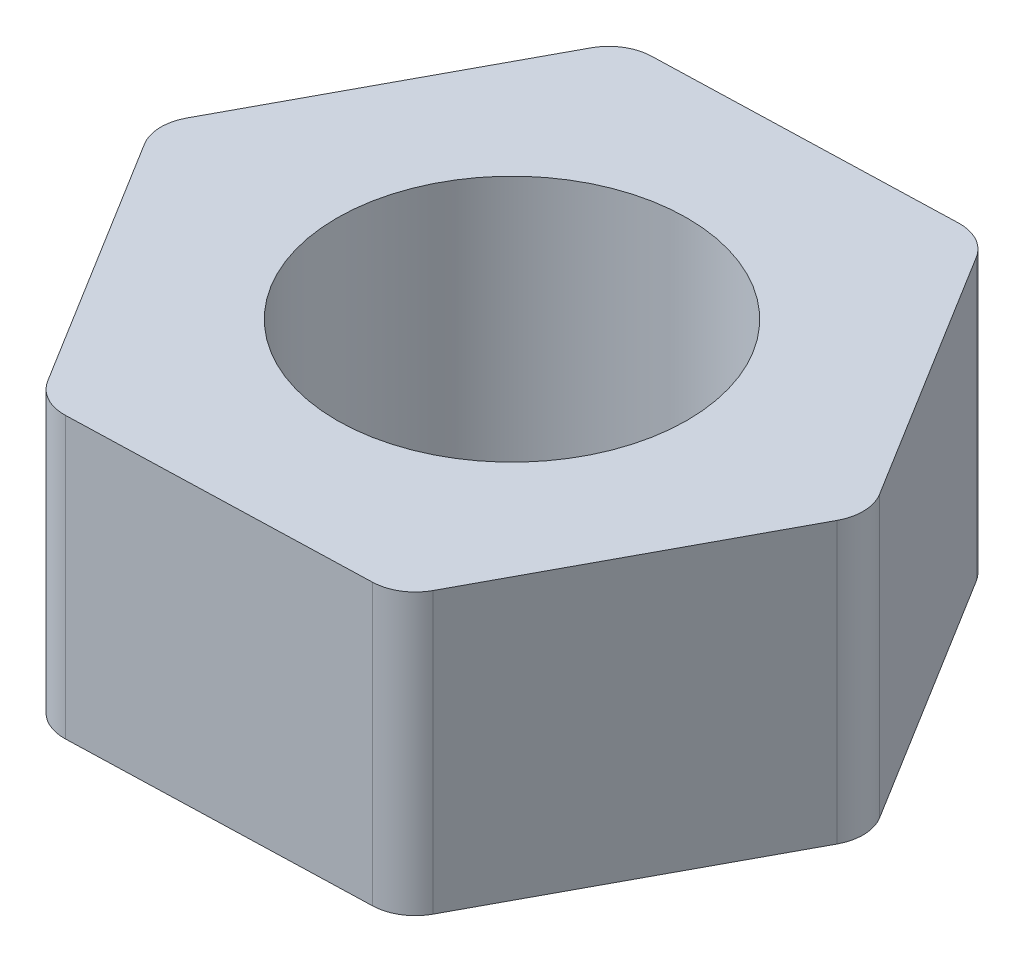
from build123d import *

# Parameters (mm, degrees)
SKETCH1_R           = 2
BOSS_EXTRUDE1_DEPTH = 3.2
FILLET1_R           = 0.5


with BuildPart() as part:
    # Sketch1 → Boss-Extrude1 (new body)
    with BuildSketch(Plane(origin=(0, 0, 0), x_dir=(1, 0, 0), z_dir=(0, 1, 0))):
        Polygon((2.095473171, -3.388066143), (3.981887935, 0.120699927), (1.886414764, 3.508766071), (-2.095473171, 3.388066143), (-3.981887935, -0.120699927), (-1.886414764, -3.508766071), align=None)
        with Locations(Location((0, 0, 0), (0, 0, 270))):
            Circle(SKETCH1_R, mode=Mode.SUBTRACT)
    extrude(amount=BOSS_EXTRUDE1_DEPTH)

    # Fillet1
    fillet1_edges = [part.edges().sort_by_distance(p)[0] for p in [
        (-1.886414764, 1.6, 3.508766071),
        (-3.981887935, 1.6, 0.120699927),
        (-2.095473171, 1.6, -3.388066143),
        (1.886414764, 1.6, -3.508766071),
        (3.981887935, 1.6, -0.120699927),
        (2.095473171, 1.6, 3.388066143),
    ]]
    fillet(fillet1_edges, radius=FILLET1_R)


solid = part.part
